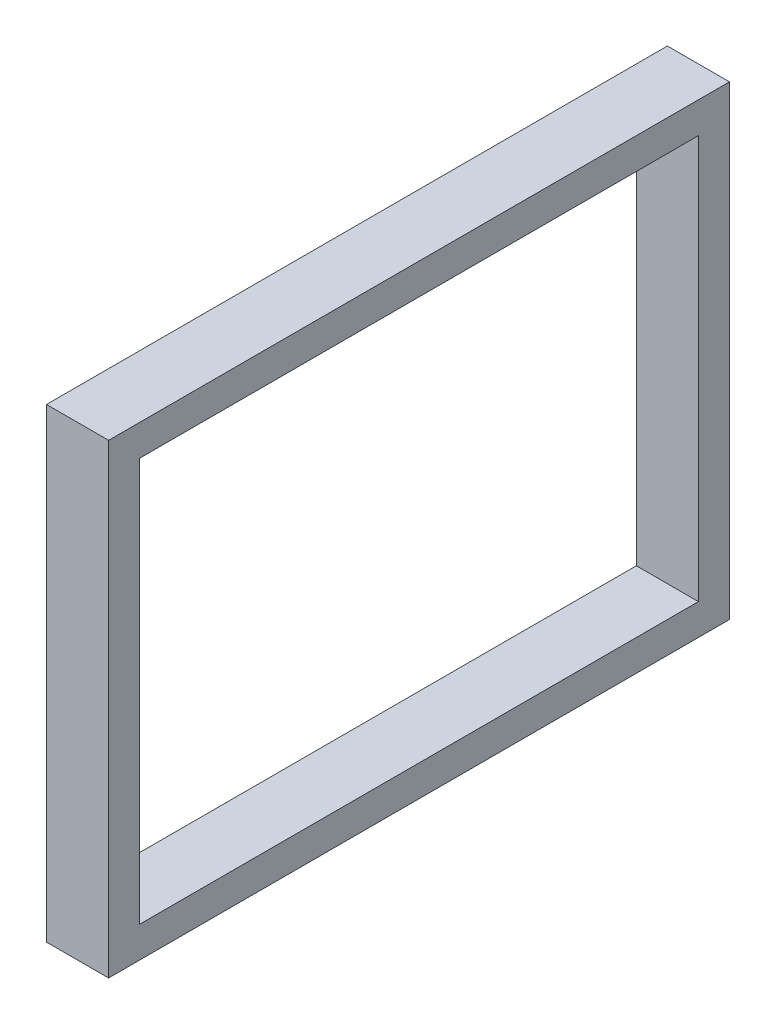
from build123d import *

# Parameters (mm, degrees)
SKETCH1_W           = 600
SKETCH1_H           = 450
SKETCH1_W_2         = 540
SKETCH1_H_2         = 390
BOSS_EXTRUDE1_DEPTH = 60


with BuildPart() as part:
    # Sketch1 → Boss-Extrude1 (new body)
    with BuildSketch(Plane(origin=(0, 0, 0), x_dir=(0, 0, -1), z_dir=(1, 0, 0))):
        Rectangle(SKETCH1_W, SKETCH1_H)
        Rectangle(SKETCH1_W_2, SKETCH1_H_2, mode=Mode.SUBTRACT)
    extrude(amount=BOSS_EXTRUDE1_DEPTH)


solid = part.part
